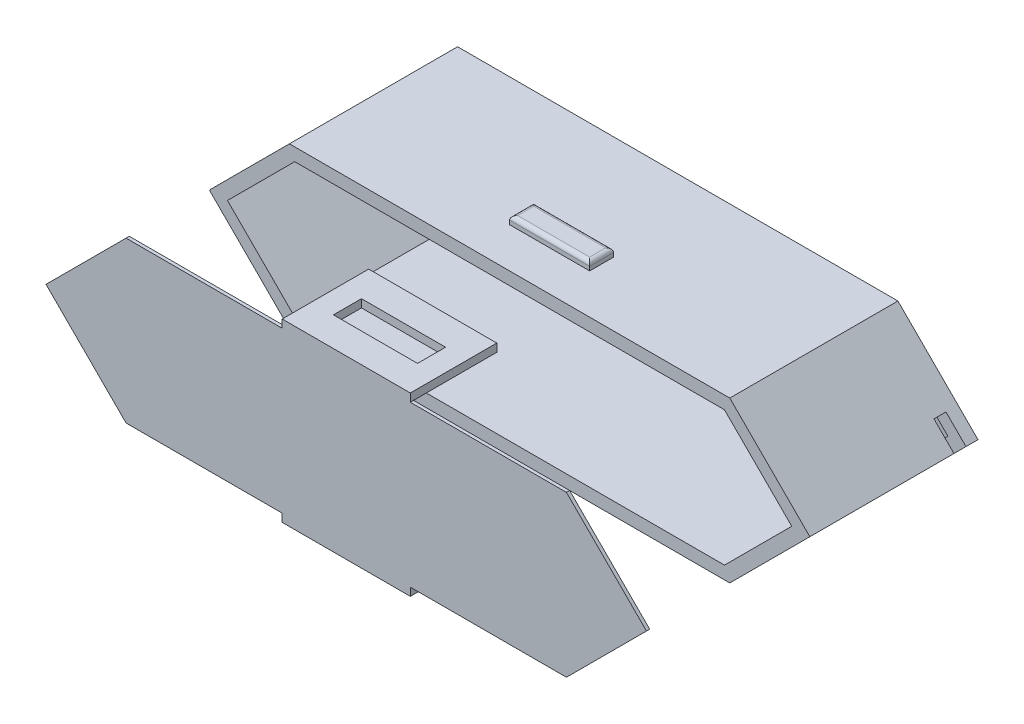
from build123d import *

# Parameters (mm, degrees)
BOSS_EXTRU_1_DEPTH           = 1
BOSS_EXTRU_2_DEPTH           = 20
ENL_V_MAT_EXTRU_1_DEPTH      = 51.671873049
ENL_V_MAT_EXTRU_1_DEPTH_BACK = 51.671873049
ESQUISSE5_W                  = 1.5
ESQUISSE5_H                  = 5
ESQUISSE9_W                  = 10
ESQUISSE9_H                  = 3
BOSS_EXTRU_5_DEPTH           = 1
CONG_1_R                     = 0.5
ESQUISSE10_W                 = 10
ESQUISSE10_H                 = 3
BOSS_EXTRU_6_DEPTH           = 1
CONG_2_R                     = 0.5
BOSS_EXTRU_7_DEPTH           = 0.4
ESQUISSE13_W                 = 16
ESQUISSE13_H                 = 10.8
ESQUISSE13_W_2               = 10.5
ESQUISSE13_H_2               = 3.5
BOSS_EXTRU_8_DEPTH           = 1


with BuildPart() as part:
    # Esquisse1 → Boss.-Extru.1 (new body)
    with BuildSketch(Plane.XY):
        Polygon((34.845351237, 9.251363312), (-20.154648763, 9.251363312), (-30.154648763, -0.748636688), (-20.154648763, -10.748636688), (34.845351237, -10.748636688), (44.845351237, -0.748636688), align=None)
    extrude(amount=BOSS_EXTRU_1_DEPTH)

    # Esquisse2 → Boss.-Extru.2 (add)
    with BuildSketch(Plane.XY.offset(1)):
        Polygon((-20.154648763, -10.748636688), (34.845351237, -10.748636688), (44.845351237, -0.748636688), (34.845351237, 9.251363312), (-20.154648763, 9.251363312), (-30.154648763, -0.748636688), align=None)
        Polygon((-19.491907063, 7.651363312), (-27.891907063, -0.748636688), (-19.491907063, -9.148636688), (34.182609538, -9.148636688), (42.582609538, -0.748636688), (34.182609538, 7.651363312), align=None, mode=Mode.SUBTRACT)
    extrude(amount=BOSS_EXTRU_2_DEPTH)

    # Esquisse5 → Enlèv. mat.-Extru.1 (cut, two sides: drawn at the far end of the back side and taken through both)
    with BuildSketch(Plane(origin=(0, 0, 0), x_dir=(0, 0, -1), z_dir=(1, 0, 0)).offset(-ENL_V_MAT_EXTRU_1_DEPTH_BACK)):
        with Locations((-2.25, -0.748636688)):
            Rectangle(ESQUISSE5_W, ESQUISSE5_H)
    extrude(amount=ENL_V_MAT_EXTRU_1_DEPTH + ENL_V_MAT_EXTRU_1_DEPTH_BACK, mode=Mode.SUBTRACT)

    # Esquisse9 → Boss.-Extru.5 (add)
    with BuildSketch(Plane(origin=(0, 9.251363312, 0), x_dir=(1, 0, 0), z_dir=(0, 1, 0))):
        with Locations((7.345351237, -14.5)):
            Rectangle(ESQUISSE9_W, ESQUISSE9_H)
    extrude(amount=BOSS_EXTRU_5_DEPTH)

    # Congé1
    cong_1_edges = [part.edges().sort_by_distance(p)[0] for p in [
        (2.345351237, 10.251363312, 14.5),
        (7.345351237, 10.251363312, 16),
        (12.345351237, 10.251363312, 14.5),
        (7.345351237, 10.251363312, 13),
    ]]
    fillet(cong_1_edges, radius=CONG_1_R)

    # Esquisse10 → Boss.-Extru.6 (add)
    with BuildSketch(Plane.XZ.offset(10.748636688)):
        with Locations((7.345351237, 14.5)):
            Rectangle(ESQUISSE10_W, ESQUISSE10_H)
    extrude(amount=BOSS_EXTRU_6_DEPTH)

    # Congé2
    cong_2_edges = [part.edges().sort_by_distance(p)[0] for p in [
        (2.345351237, -11.748636688, 14.5),
        (7.345351237, -11.748636688, 13),
        (12.345351237, -11.748636688, 14.5),
        (7.345351237, -11.748636688, 16),
    ]]
    fillet(cong_2_edges, radius=CONG_2_R)


with BuildPart() as body_2:
    # Esquisse12 → Boss.-Extru.7 (new body)
    with BuildSketch(Plane.XY.offset(41)):
        Polygon((44.845351237, -0.748636688), (34.845351237, 9.251363312), (-20.154648763, 9.251363312), (-30.154648763, -0.748636688), (-20.154648763, -10.748636688), (34.845351237, -10.748636688), align=None)
    extrude(amount=BOSS_EXTRU_7_DEPTH)

    # Esquisse13 → Boss.-Extru.8 (add)
    with BuildSketch(Plane(origin=(0, 9.251363312, 0), x_dir=(1, 0, 0), z_dir=(0, 1, 0))):
        with Locations((7.345351237, -36)):
            Rectangle(ESQUISSE13_W, ESQUISSE13_H)
        with Locations((7.345351237, -36)):
            Rectangle(ESQUISSE13_W_2, ESQUISSE13_H_2, mode=Mode.SUBTRACT)
    boss_extru_8 = extrude(amount=BOSS_EXTRU_8_DEPTH)

    # Symétrie1: Boss.-Extru.8 across plane
    add(boss_extru_8.mirror(Plane.ZX.offset(-0.748636688)))


solid = Compound([part.part, body_2.part])
